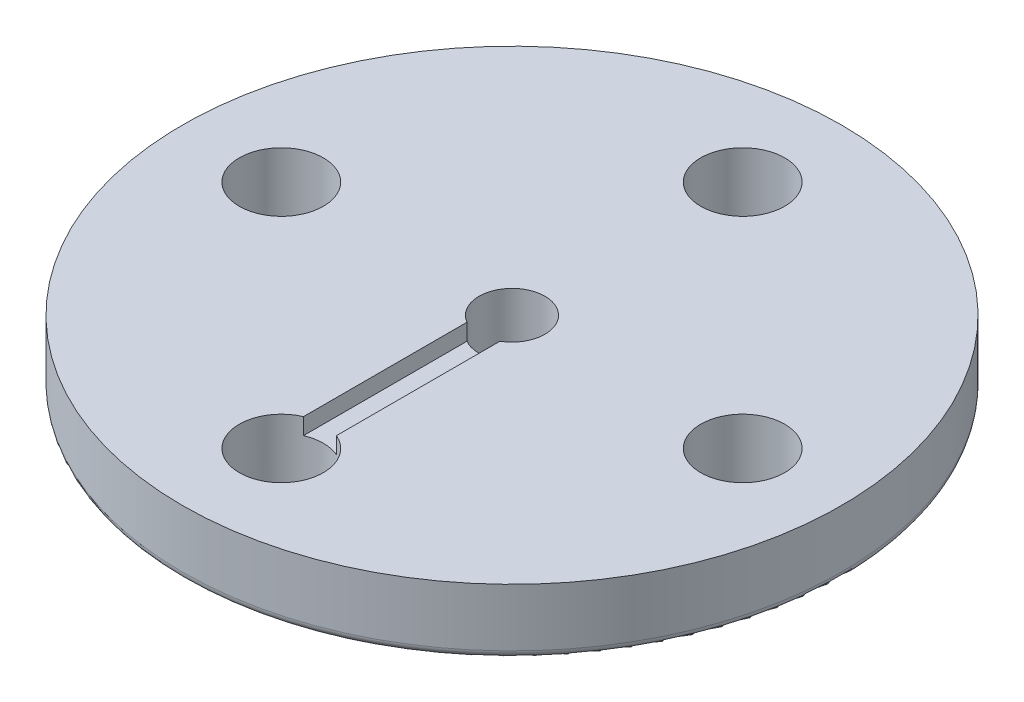
from build123d import *

# Parameters (mm, degrees)
SKETCH1_R           = 10
BOSS_EXTRUDE1_DEPTH = 2
SKETCH2_R           = 4.5
BOSS_EXTRUDE2_DEPTH = 2.5
SKETCH3_R           = 1.275
CUT_EXTRUDE1_DEPTH  = 15.361406616
FILLET1_R           = 0.25
SKETCH6_R           = 1
CUT_EXTRUDE2_DEPTH  = 15.840822214
SKETCH7_R           = 2.9
CUT_EXTRUDE3_DEPTH  = 2.5
BOSS_EXTRUDE4_DEPTH = 2.5
CIRPATTERN1_COUNT   = 26
SKETCH9_W           = 1
SKETCH9_H           = 7
CUT_EXTRUDE4_DEPTH  = 0.5


with BuildPart() as part:
    # Sketch1 → Boss-Extrude1 (new body)
    with BuildSketch(Plane(origin=(0, 0, 0), x_dir=(1, 0, 0), z_dir=(0, 1, 0))):
        with Locations(Location((0, 0, 0), (0, 0, 270))):
            Circle(SKETCH1_R)
    extrude(amount=BOSS_EXTRUDE1_DEPTH)

    # Sketch2 → Boss-Extrude2 (add)
    with BuildSketch(Plane(origin=(0, 0, 0), x_dir=(1, 0, 0), z_dir=(0, 1, 0))):
        with Locations(Location((0, 0, 0), (0, 0, 270))):
            Circle(SKETCH2_R)
    extrude(amount=-BOSS_EXTRUDE2_DEPTH)

    # Sketch3 → Cut-Extrude1 (cut, through all)
    with BuildSketch(Plane(origin=(0, 0, 0), x_dir=(1, 0, 0), z_dir=(0, 1, 0))):
        with Locations(Location((0, 7, 0), (0, 0, 270))):
            Circle(SKETCH3_R)
        with Locations(Location((-7, 0, 0), (0, 0, 270))):
            Circle(SKETCH3_R)
        with Locations(Location((0, -7, 0), (0, 0, 90))):
            Circle(SKETCH3_R)
        with Locations(Location((7, 0, 0), (0, 0, 90))):
            Circle(SKETCH3_R)
    extrude(amount=CUT_EXTRUDE1_DEPTH, mode=Mode.SUBTRACT)

    # Fillet1
    fillet1_edges = [part.edges().sort_by_distance(p)[0] for p in [
        (0, 0, -10),
    ]]
    fillet(fillet1_edges, radius=FILLET1_R)

    # Sketch6 → Cut-Extrude2 (cut, through all)
    with BuildSketch(Plane(origin=(0, 2, 0), x_dir=(1, 0, 0), z_dir=(0, 1, 0))):
        with Locations(Location((0, 0, 0), (0, 0, 270))):
            Circle(SKETCH6_R)
    extrude(amount=-CUT_EXTRUDE2_DEPTH, mode=Mode.SUBTRACT)

    # Sketch7 → Cut-Extrude3 (cut)
    with BuildSketch(Plane.XZ.offset(2.5)):
        with Locations(Location((0, 0, 0), (0, 0, 270))):
            Circle(SKETCH7_R)
    extrude(amount=-CUT_EXTRUDE3_DEPTH, mode=Mode.SUBTRACT)

    # Sketch8 → Boss-Extrude4 (add)
    with BuildSketch(Plane.XZ.offset(2.5)):
        with BuildLine():
            Line((-2.35244742, -1.046531787), (-2.745588284, -0.933672842))
            ThreePointArc((-2.745588284, -0.933672842), (-2.649635472, -1.178741646), (-2.531859978, -1.414102207))
            Line((-2.531859978, -1.414102207), (-2.35244742, -1.046531787))
        make_face()
    boss_extrude4 = extrude(amount=-BOSS_EXTRUDE4_DEPTH)

    # CirPattern1: Boss-Extrude4 ×26 about axis
    cirpattern1_axis = Axis((0, 0, 0), (0, 1, 0))
    for i in range(1, CIRPATTERN1_COUNT):
        add(boss_extrude4.rotate(cirpattern1_axis, i * 360 / CIRPATTERN1_COUNT))

    # Sketch9 → Cut-Extrude4 (cut)
    with BuildSketch(Plane(origin=(0, 2, 0), x_dir=(1, 0, 0), z_dir=(0, 1, 0))):
        with Locations((0, -3.5)):
            Rectangle(SKETCH9_W, SKETCH9_H)
    extrude(amount=-CUT_EXTRUDE4_DEPTH, mode=Mode.SUBTRACT)


solid = part.part
